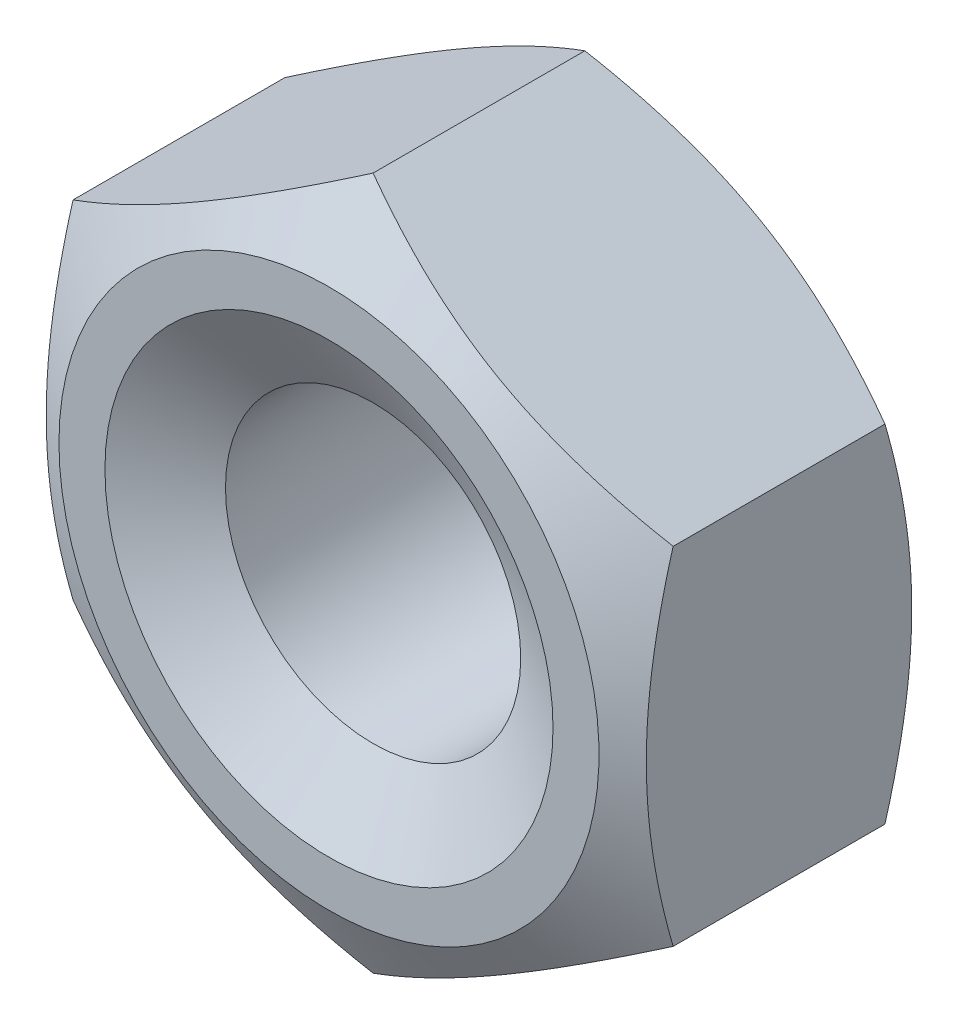
from build123d import *

# Parameters (mm, degrees)
SKETCH_1_R        = 2.46
EXTRUDE_777_DEPTH = 5


with BuildPart() as part:
    # Эскиз1 → Extrude 777 (new body)
    with BuildSketch(Plane.XY):
        Polygon((0, 5.773502692), (-5, 2.886751346), (-5, -2.886751346), (0, -5.773502692), (5, -2.886751346), (5, 2.886751346), align=None)
        Circle(SKETCH_1_R, mode=Mode.SUBTRACT)
    extrude(amount=EXTRUDE_777_DEPTH)

    # Эскиз2 → Вырез-Повернуть1 (revolve, cut)
    with BuildSketch(Plane(origin=(0, 0, 0), x_dir=(0, 0, -1), z_dir=(1, 0, 0))):
        Polygon((-5, 4.5), (-5, 5.773502692), (-4.264742878, 5.773502692), align=None)
        Polygon((-4.264742878, 2.46), (-5, 2.46), (-5, 3.733502692), align=None)
        Polygon((0, 3.733502692), (0, 2.46), (-0.735257122, 2.46), align=None)
        Polygon((0, 4.5), (-0.735257122, 5.773502692), (0, 5.773502692), align=None)
    revolve(axis=Axis((0, 0, 0), (0, 0, 1)), mode=Mode.SUBTRACT)


with BuildPart() as body_2:
    # Эскиз2<3> → Revolve 1099 (revolve)
    with BuildSketch(Plane(origin=(0, 0, 0), x_dir=(0, 0, -1), z_dir=(1, 0, 0))):
        Polygon((0, 2.46), (0, 3.733502692), (-0.735257122, 2.46), align=None)
    revolve(axis=Axis((0, 0, 0), (0, 0, 1)))


solid = Compound([part.part, body_2.part])
